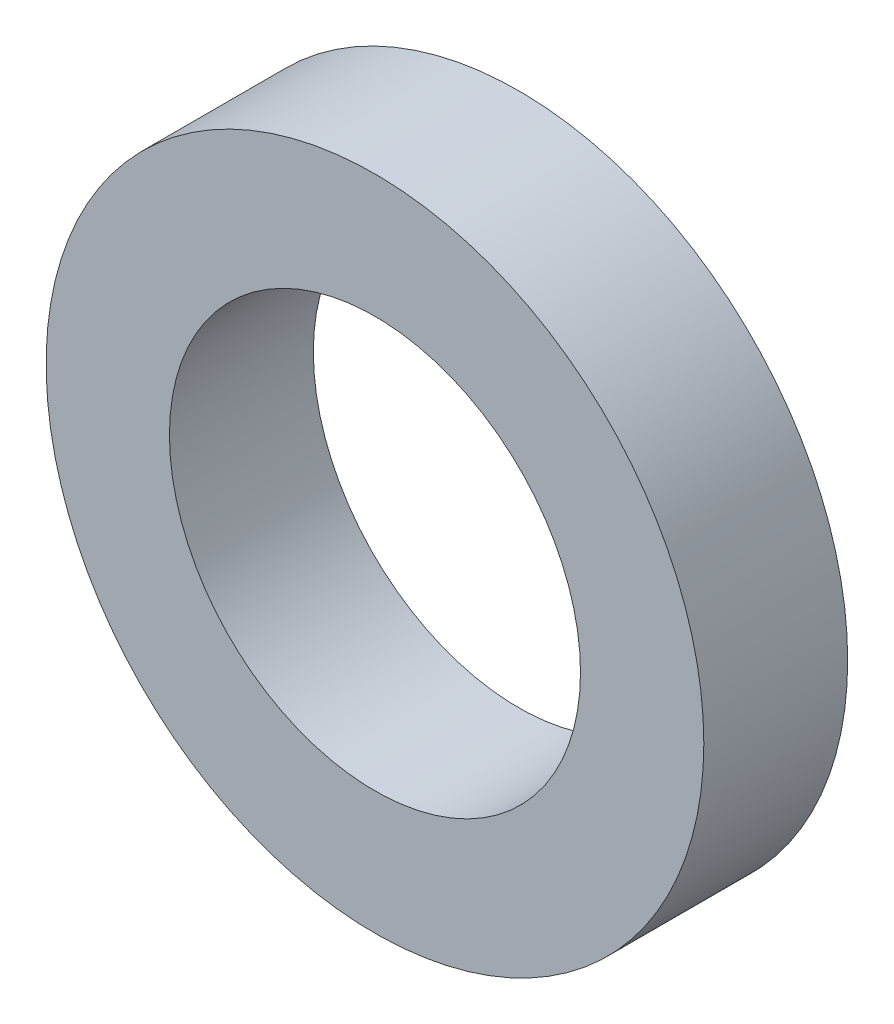
from build123d import *

# Parameters (mm, degrees)
F_0326_CYLINDER_SKETCH_R = 16
F_0326_CYLINDER_DEPTH    = 7
F_0327_CYLINDER_SKETCH_R = 10
F_0327_CYLINDER_DEPTH    = 8


with BuildPart() as part:
    # 0326_cylinder_Sketch → 0326_cylinder (new body)
    with BuildSketch(Plane.XY):
        Circle(F_0326_CYLINDER_SKETCH_R)
    extrude(amount=F_0326_CYLINDER_DEPTH)


with BuildPart() as part_1:
    # 0326_cylinder_Translate: moved
    add(part.part.moved(Location((0, 0, -3.5))))


with BuildPart() as body_2:
    # 0327_cylinder_Sketch → 0327_cylinder (new body)
    with BuildSketch(Plane.XY):
        Circle(F_0327_CYLINDER_SKETCH_R)
    extrude(amount=F_0327_CYLINDER_DEPTH)


with BuildPart() as body_2_1:
    # 0327_cylinder_Translate: moved
    add(body_2.part.moved(Location((0, 0, -4))))


with BuildPart() as part_2:
    add(part_1.part)

    # 0328_sub: cut body 2
    add(body_2_1.part, mode=Mode.SUBTRACT)


solid = part_2.part
